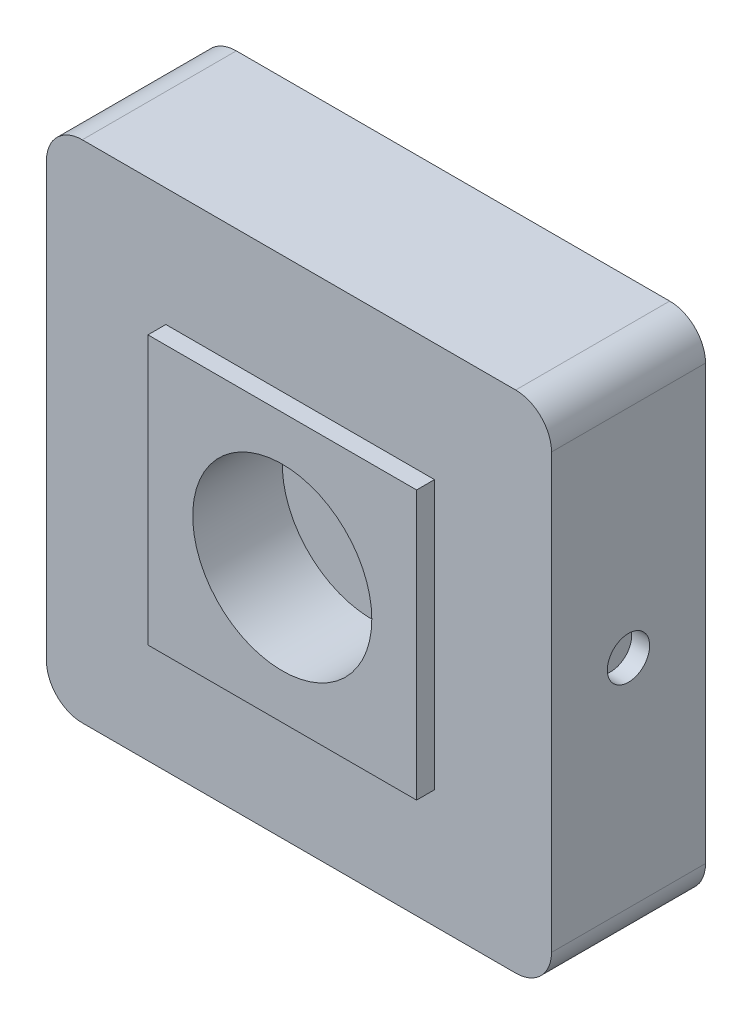
from build123d import *

# Parameters (mm, degrees)
BOSS_EXTRUDE1_DEPTH = 10.922
SKETCH2_W           = 19.05
SKETCH2_H           = 19.05
BOSS_EXTRUDE2_DEPTH = 1.27
SKETCH3_R           = 6.35
CUT_EXTRUDE1_DEPTH  = 6.35
SKETCH4_R           = 1.500000048
CUT_EXTRUDE2_DEPTH  = 1.27
CUT_EXTRUDE3_START  = -1.27
SKETCH5_R           = 1.500000048
CUT_EXTRUDE3_DEPTH  = 1.27


with BuildPart() as part:
    # Sketch1 → Boss-Extrude1 (new body)
    with BuildSketch(Plane.XY):
        with BuildLine():
            Line((2.54, 0), (33.274, 0))
            ThreePointArc((33.274, 0), (35.070051224, 0.743948776), (35.814, 2.54))
            Line((35.814, 2.54), (35.814, 33.274))
            ThreePointArc((35.814, 33.274), (35.070051224, 35.070051224), (33.274, 35.814))
            Line((33.274, 35.814), (2.54, 35.814))
            ThreePointArc((2.54, 35.814), (0.743948776, 35.070051224), (0, 33.274))
            Line((0, 33.274), (0, 2.54))
            ThreePointArc((0, 2.54), (0.743948776, 0.743948776), (2.54, 0))
        make_face()
    extrude(amount=BOSS_EXTRUDE1_DEPTH)

    # Sketch2 → Boss-Extrude2 (add)
    with BuildSketch(Plane.XY.offset(10.922)):
        with Locations((17.990434567, 17.907)):
            Rectangle(SKETCH2_W, SKETCH2_H)
    extrude(amount=BOSS_EXTRUDE2_DEPTH)

    # Sketch3 → Cut-Extrude1 (cut)
    with BuildSketch(Plane.XY.offset(12.192)):
        with Locations((17.990434567, 17.907)):
            Circle(SKETCH3_R)
    extrude(amount=-CUT_EXTRUDE1_DEPTH, mode=Mode.SUBTRACT)

    # Sketch4 → Cut-Extrude2 (cut)
    with BuildSketch(Plane.ZY):
        with Locations((5.461, 17.907)):
            Circle(SKETCH4_R)
    extrude(amount=-CUT_EXTRUDE2_DEPTH, mode=Mode.SUBTRACT)

    # Sketch5 → Cut-Extrude3 (cut)
    with BuildSketch(Plane(origin=(35.814, 0, 0), x_dir=(0, 0, -1), z_dir=(1, 0, 0)).offset(CUT_EXTRUDE3_START)):
        with Locations(Location((-5.461, 17.907, 0), (0, 0, 180))):
            Circle(SKETCH5_R)
    extrude(amount=CUT_EXTRUDE3_DEPTH, mode=Mode.SUBTRACT)


solid = part.part
